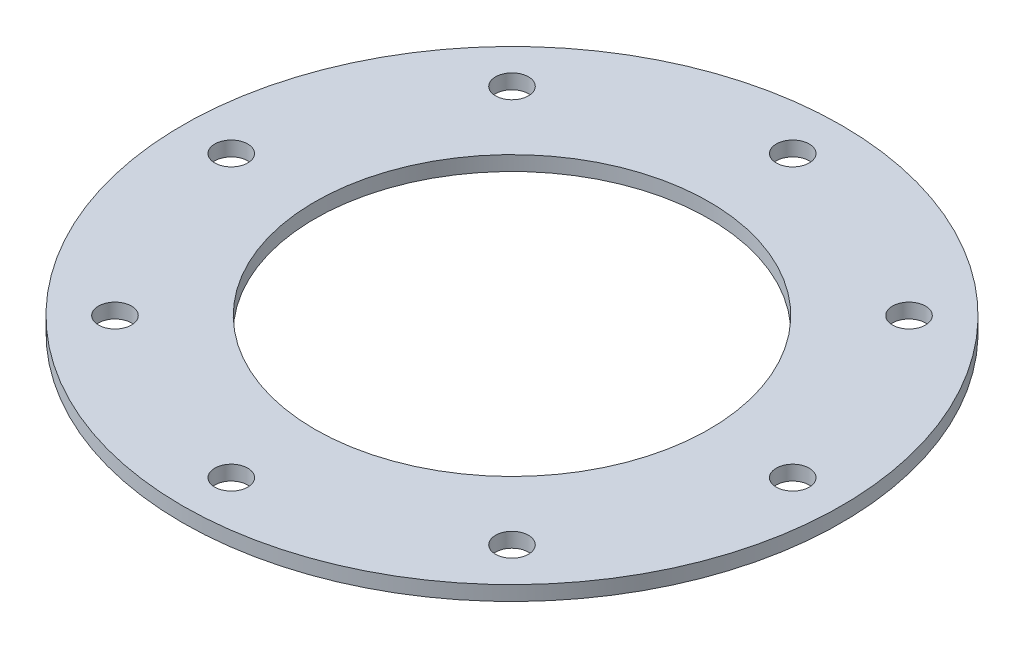
from build123d import *

# Parameters (mm, degrees)
SKETCH1_R             = 135
SKETCH1_R_2           = 80.75
BOSS_EXTRUDE1_DEPTH   = 6
M12_CLEARANCE_HOLE1_D = 13.5


with BuildPart() as part:
    # Sketch1 → Boss-Extrude1 (new body)
    with BuildSketch(Plane(origin=(0, 0, 0), x_dir=(1, 0, 0), z_dir=(0, 1, 0))):
        with Locations(Location((0, 0, 0), (0, 0, 270))):
            Circle(SKETCH1_R)
        with Locations(Location((0, 0, 0), (0, 0, 270))):
            Circle(SKETCH1_R_2, mode=Mode.SUBTRACT)
    extrude(amount=BOSS_EXTRUDE1_DEPTH)

    # M12 Clearance Hole1 (through all)
    with Locations(Plane(origin=(0, 6, 0), x_dir=(1, 0, 0), z_dir=(0, 1, 0))):
        with Locations((0, 115), (81.317279836, 81.317279836), (115, 0), (81.317279836, -81.317279836), (0, -115), (-81.317279836, -81.317279836), (-115, 0), (-81.317279836, 81.317279836), (0, 0)):
            Hole(M12_CLEARANCE_HOLE1_D / 2)


solid = part.part
